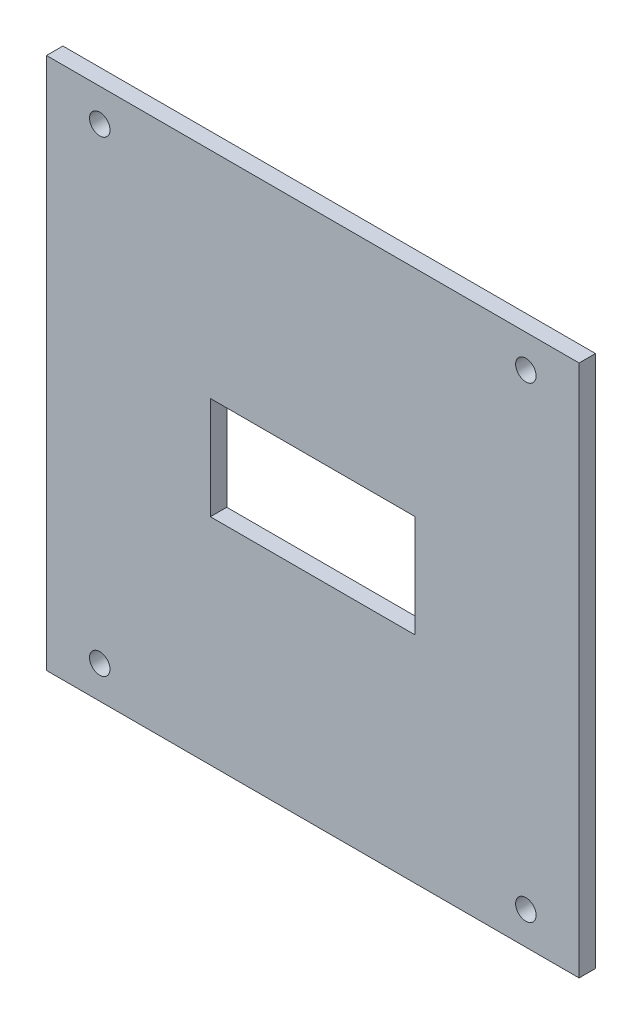
from build123d import *

# Parameters (mm, degrees)
BOSS_EXTRUDE1_DEPTH         = 2
BOSS_EXTRUDE1_DEPTH_BACK    = 2
SKETCH1_W                   = 130
SKETCH1_H                   = 130
TAP_DRILL_FOR_M5X0_8_TAP1_D = 5
SKETCH5_W                   = 50
SKETCH5_H                   = 25
CUT_EXTRUDE2_DEPTH          = 20


with BuildPart() as part:
    # Sketch1 → Boss-Extrude1 (new, two sides: drawn at the far end of the back side and taken through both)
    with BuildSketch(Plane.XY.offset(-BOSS_EXTRUDE1_DEPTH_BACK)):
        Rectangle(SKETCH1_W, SKETCH1_H)
    extrude(amount=BOSS_EXTRUDE1_DEPTH + BOSS_EXTRUDE1_DEPTH_BACK)

    # Tap Drill for M5x0.8 Tap1 (through all)
    with Locations(Plane(origin=(0, 0, -2), x_dir=(-1, 0, 0), z_dir=(0, 0, -1))):
        with Locations((-52, 57), (52, 57), (52, -57), (-52, -57)):
            Hole(TAP_DRILL_FOR_M5X0_8_TAP1_D / 2)

    # Sketch5 → Cut-Extrude2 (cut)
    with BuildSketch(Plane(origin=(0, 0, -2), x_dir=(-1, 0, 0), z_dir=(0, 0, -1))):
        Rectangle(SKETCH5_W, SKETCH5_H)
    extrude(amount=-CUT_EXTRUDE2_DEPTH, mode=Mode.SUBTRACT)


solid = part.part
